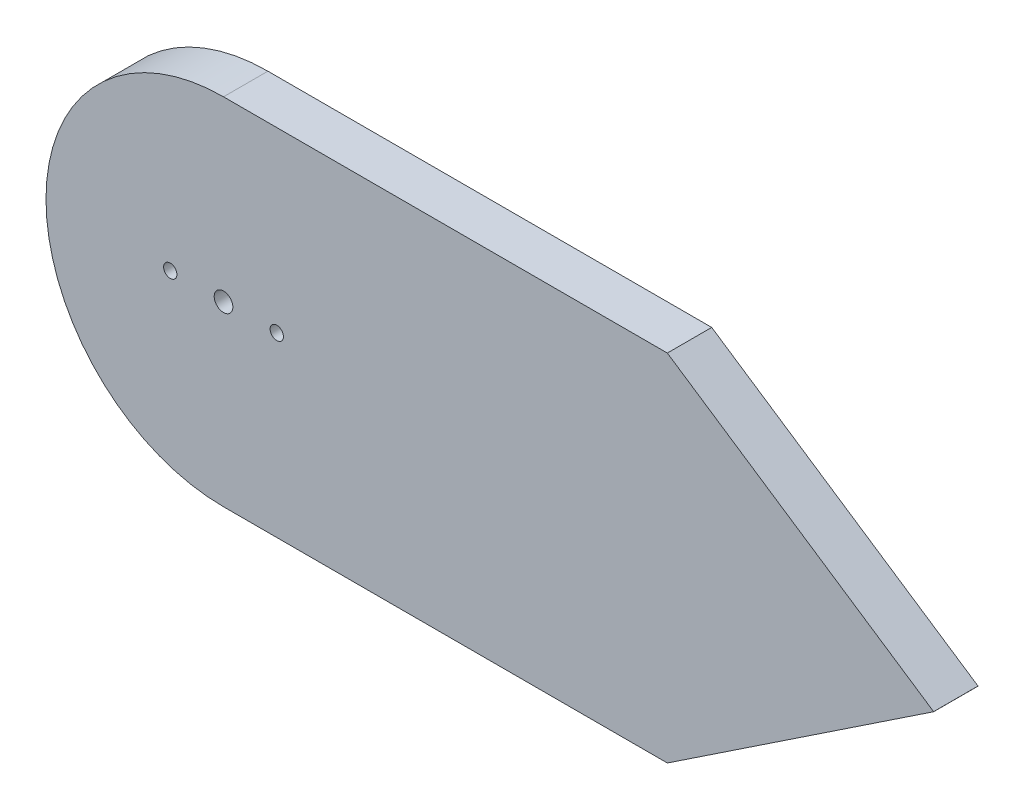
from build123d import *

# Parameters (mm, degrees)
BOSS_EXTRUDE1_DEPTH   = 5
BODY_MOVE_COPY1_ANGLE = 90
CUT_EXTRUDE2_REACH    = 84.614
SKETCH8_R             = 1.05
SKETCH8_R_2           = 0.75


with BuildPart() as part:
    # Sketch1 → Boss-Extrude1 (new body)
    with BuildSketch(Plane(origin=(0, 0, 0), x_dir=(1, 0, 0), z_dir=(0, 1, 0))):
        with BuildLine():
            Line((50, -20), (0, -20))
            ThreePointArc((0, -20), (-20, 0), (0, 20))
            Line((0, 20), (50, 20))
            Line((50, 20), (80, 0.010830805))
            Line((80, 0.010830805), (80, 0))
            Line((80, 0), (50, -20))
        make_face()
    extrude(amount=BOSS_EXTRUDE1_DEPTH)


with BuildPart() as part_1:
    # Body-Move/Copy1: moved
    add(part.part.rotate(Axis((0, 0, 0), (1, 0, 0)), BODY_MOVE_COPY1_ANGLE))

    # Sketch8 → Cut-Extrude2 (cut, up to next)
    with BuildSketch(Plane.XY.offset(5), mode=Mode.PRIVATE) as cut_extrude2_sk1:
        Circle(SKETCH8_R)
    cut_extrude2_tool1 = extrude(cut_extrude2_sk1.sketch, amount=-CUT_EXTRUDE2_REACH, mode=Mode.PRIVATE) & part_1.part
    # Sketch8 → Cut-Extrude2 (cut, up to next)
    with BuildSketch(Plane.XY.offset(5), mode=Mode.PRIVATE) as cut_extrude2_sk2:
        with Locations((6, -0.032589943)):
            Circle(SKETCH8_R_2)
    cut_extrude2_tool2 = extrude(cut_extrude2_sk2.sketch, amount=-CUT_EXTRUDE2_REACH, mode=Mode.PRIVATE) & part_1.part
    # Sketch8 → Cut-Extrude2 (cut, up to next)
    with BuildSketch(Plane.XY.offset(5), mode=Mode.PRIVATE) as cut_extrude2_sk3:
        with Locations((-5.999934973, 0.027934237)):
            Circle(SKETCH8_R_2)
    cut_extrude2_tool3 = extrude(cut_extrude2_sk3.sketch, amount=-CUT_EXTRUDE2_REACH, mode=Mode.PRIVATE) & part_1.part
    add(cut_extrude2_tool1.solids().sort_by_distance((0, 0, 5))[0], mode=Mode.SUBTRACT)
    add(cut_extrude2_tool2.solids().sort_by_distance((6, -0.03259, 5))[0], mode=Mode.SUBTRACT)
    add(cut_extrude2_tool3.solids().sort_by_distance((-5.999935, 0.027934, 5))[0], mode=Mode.SUBTRACT)


with BuildPart() as part_2:
    # Body-Move/Copy4: moved
    add(part_1.part.moved(Location((0, 0, -3))))


solid = part_2.part
